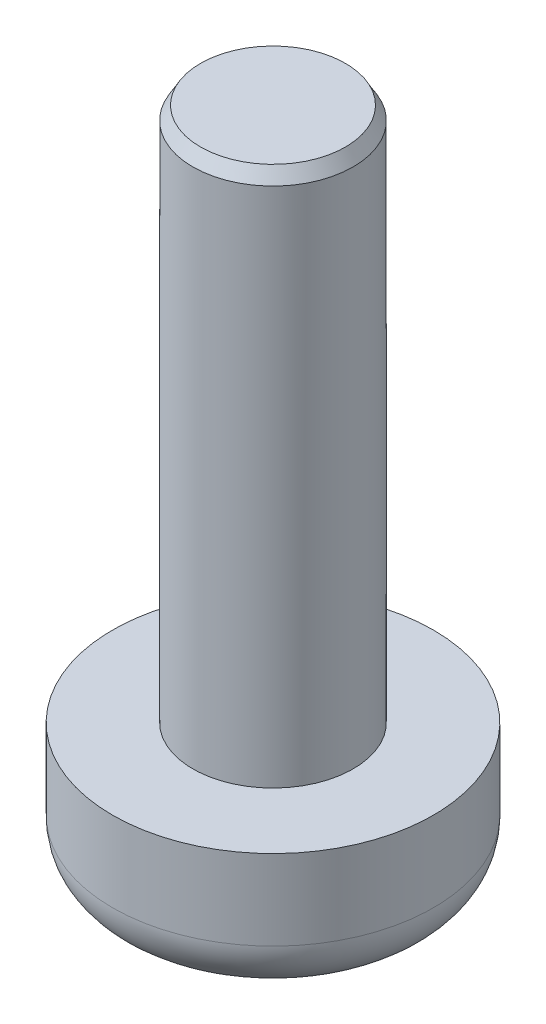
from build123d import *

# Parameters (mm, degrees)
SKETCH1_R           = 1.5
BOSS_EXTRUDE1_DEPTH = 10
CHAMFER1_SIZE       = 0.25
CHAMFER1_SIZE2      = 0.144337567
SKETCH2_R           = 3
BOSS_EXTRUDE2_DEPTH = 2.5
FILLET1_R           = 1
CUT_EXTRUDE1_DEPTH  = 2


with BuildPart() as part:
    # Sketch1 → Boss-Extrude1 (new body)
    with BuildSketch(Plane(origin=(0, 0, 0), x_dir=(1, 0, 0), z_dir=(0, 1, 0))):
        with Locations(Location((0, 0, 0), (0, 0, 270))):
            Circle(SKETCH1_R)
    extrude(amount=BOSS_EXTRUDE1_DEPTH)

    # Chamfer1
    chamfer1_edges = [part.edges().sort_by_distance(p)[0] for p in [
        (0, 10, -1.5),
    ]]
    chamfer1_side = [part.faces().sort_by_distance(p)[0] for p in [
        (0, 5, -1.5),
    ]]
    chamfer(chamfer1_edges, length=CHAMFER1_SIZE, length2=CHAMFER1_SIZE2, reference=chamfer1_side[0])

    # Sketch2 → Boss-Extrude2 (add)
    with BuildSketch(Plane(origin=(0, 0, 0), x_dir=(-1, 0, 0), z_dir=(0, -1, 0))):
        with Locations(Location((0, 0, 0), (0, 0, 90))):
            Circle(SKETCH2_R)
    extrude(amount=BOSS_EXTRUDE2_DEPTH)

    # Fillet1
    fillet1_edges = [part.edges().sort_by_distance(p)[0] for p in [
        (0, -2.5, 3),
    ]]
    fillet(fillet1_edges, radius=FILLET1_R)

    # Sketch3 → Cut-Extrude1 (cut)
    with BuildSketch(Plane(origin=(0, -2.5, 0), x_dir=(-1, 0, 0), z_dir=(0, -1, 0))):
        Polygon((1.58771324, 0), (0.79385662, 1.375), (-0.79385662, 1.375), (-1.58771324, 0), (-0.79385662, -1.375), (0.79385662, -1.375), align=None)
    extrude(amount=-CUT_EXTRUDE1_DEPTH, mode=Mode.SUBTRACT)


solid = part.part
